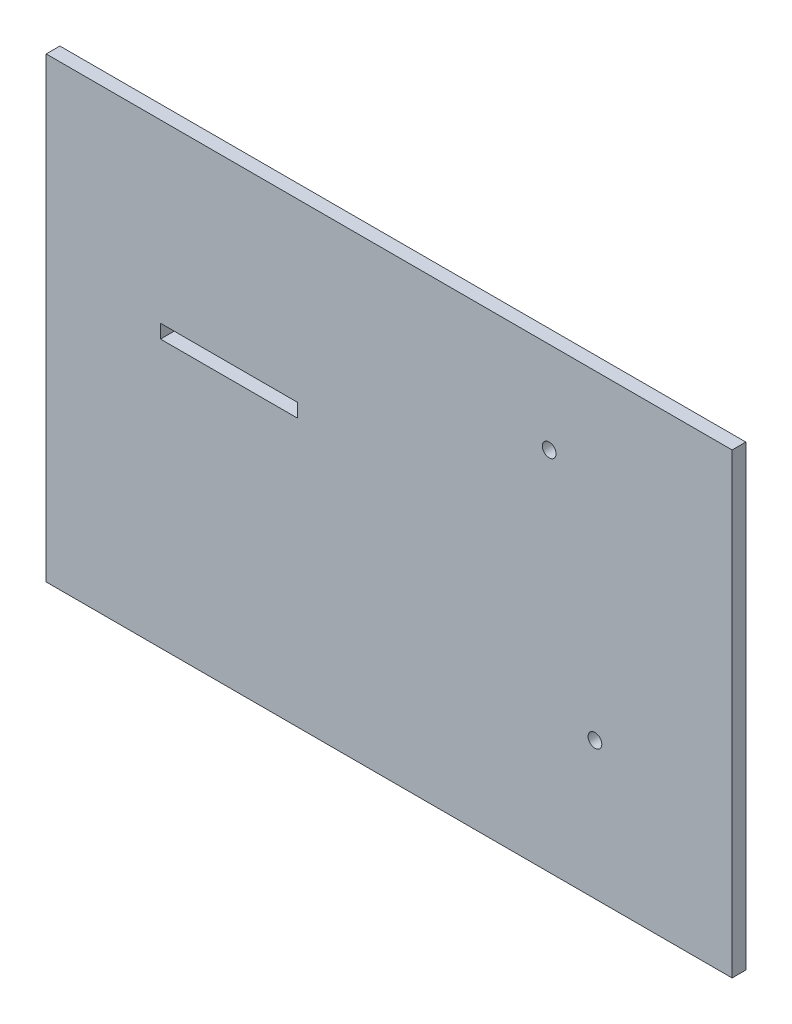
from build123d import *

# Parameters (mm, degrees)
SKETCH_1_W          = 150
SKETCH_1_H          = 100
EXTRUDE_2_DEPTH     = 3
SKETCH_2_R          = 1.5
CUT_EXTRUDE_1_DEPTH = 181.302523554
SKETCH_3_W          = 30
SKETCH_3_H          = 3
CUT_EXTRUDE_2_DEPTH = 181.302523554


with BuildPart() as part:
    # 草图1 → 凸台-拉伸2 (new body)
    with BuildSketch(Plane.XY):
        with Locations((-75, 50)):
            Rectangle(SKETCH_1_W, SKETCH_1_H)
    extrude(amount=EXTRUDE_2_DEPTH)

    # 草图2 → 切除-拉伸1 (cut, through all)
    with BuildSketch(Plane.XY.offset(3)):
        with Locations((-30, 30)):
            Circle(SKETCH_2_R)
        with Locations((-40, 80)):
            Circle(SKETCH_2_R)
    extrude(amount=-CUT_EXTRUDE_1_DEPTH, mode=Mode.SUBTRACT)

    # 草图3 → 切除-拉伸2 (cut, through all)
    with BuildSketch(Plane.XY.offset(3)):
        with Locations((-110, 60)):
            Rectangle(SKETCH_3_W, SKETCH_3_H)
    extrude(amount=-CUT_EXTRUDE_2_DEPTH, mode=Mode.SUBTRACT)


solid = part.part
